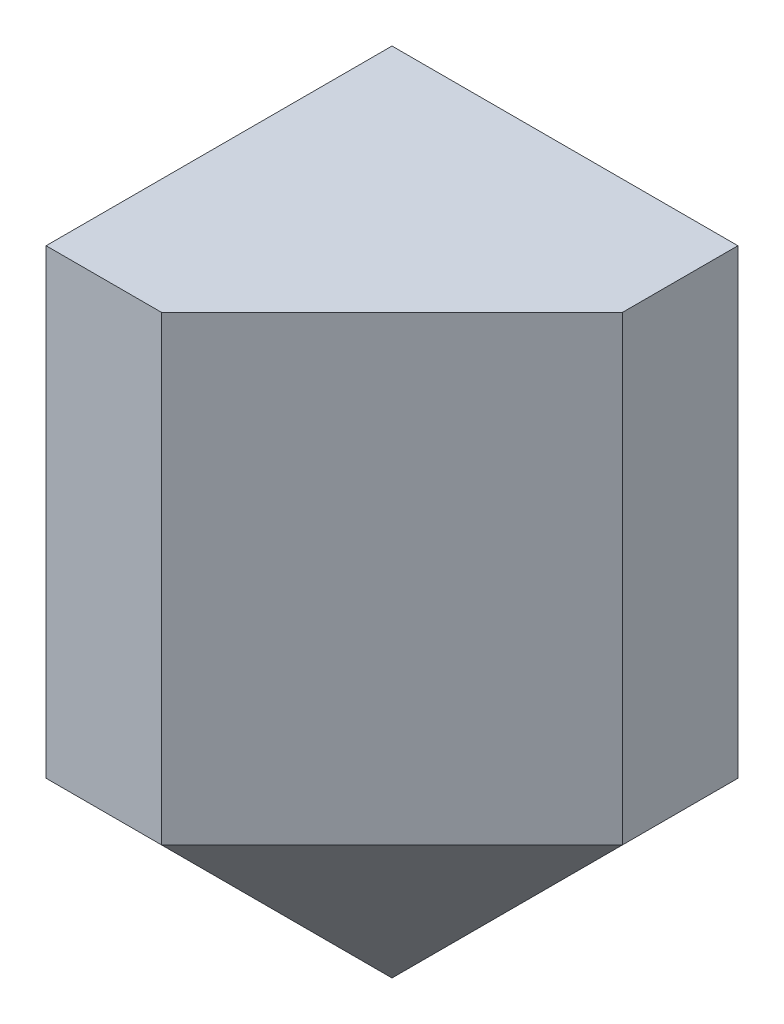
from build123d import *

# Parameters (mm, degrees)
SCHIZZO1_W                   = 30
SCHIZZO1_H                   = 40
ESTRUSIONE_ESTRUSIONE1_DEPTH = 30
SMUSSO1_SIZE                 = 20
ESTRUSIONE_ESTRUSIONE2_DEPTH = 20
FORO_PER_VITE_M5_1_D         = 5.5
FORO_PER_VITE_M5_1_DEPTH     = 13
FORO_PER_VITE_M5_1_TIP       = 1.652366702
FORO_PER_VITE_M5_2_D         = 5.5
FORO_PER_VITE_M5_2_DEPTH     = 13
FORO_PER_VITE_M5_2_TIP       = 1.652366702


with BuildPart() as part:
    # Schizzo1 → Estrusione-Estrusione1 (new body)
    with BuildSketch(Plane.XY):
        with Locations((15, 20)):
            Rectangle(SCHIZZO1_W, SCHIZZO1_H)
    extrude(amount=ESTRUSIONE_ESTRUSIONE1_DEPTH)

    # Smusso1
    smusso1_edges = [part.edges().sort_by_distance(p)[0] for p in [
        (30, 20, 30),
        (30, 0, 15),
        (15, 0, 30),
    ]]
    chamfer(smusso1_edges, length=SMUSSO1_SIZE)

    # Schizzo2 → Estrusione-Estrusione2 (add)
    with BuildSketch(Plane(origin=(0, 40, 0), x_dir=(1, 0, 0), z_dir=(0, 1, 0))):
        Polygon((0, 0), (30, 0), (30, -10), (10, -30), (0, -30), align=None)
    extrude(amount=ESTRUSIONE_ESTRUSIONE2_DEPTH)

    # Foro per Vite M5-1
    with Locations(Plane.ZY):
        with Locations((18, 20), (14, 48)):
            Hole(FORO_PER_VITE_M5_1_D / 2, depth=FORO_PER_VITE_M5_1_DEPTH)
            with Locations((0, 0, -(FORO_PER_VITE_M5_1_DEPTH + FORO_PER_VITE_M5_1_TIP / 2))):  # 118° drill point
                Cone(0, FORO_PER_VITE_M5_1_D / 2, FORO_PER_VITE_M5_1_TIP, mode=Mode.SUBTRACT)

    # Foro per Vite M5-2
    with Locations(Plane(origin=(18, 20, 0), x_dir=(-1, 0, 0), z_dir=(0, 0, -1))):
        with Locations((0, 0), (0, 28)):
            Hole(FORO_PER_VITE_M5_2_D / 2, depth=FORO_PER_VITE_M5_2_DEPTH)
            with Locations((0, 0, -(FORO_PER_VITE_M5_2_DEPTH + FORO_PER_VITE_M5_2_TIP / 2))):  # 118° drill point
                Cone(0, FORO_PER_VITE_M5_2_D / 2, FORO_PER_VITE_M5_2_TIP, mode=Mode.SUBTRACT)


solid = part.part
